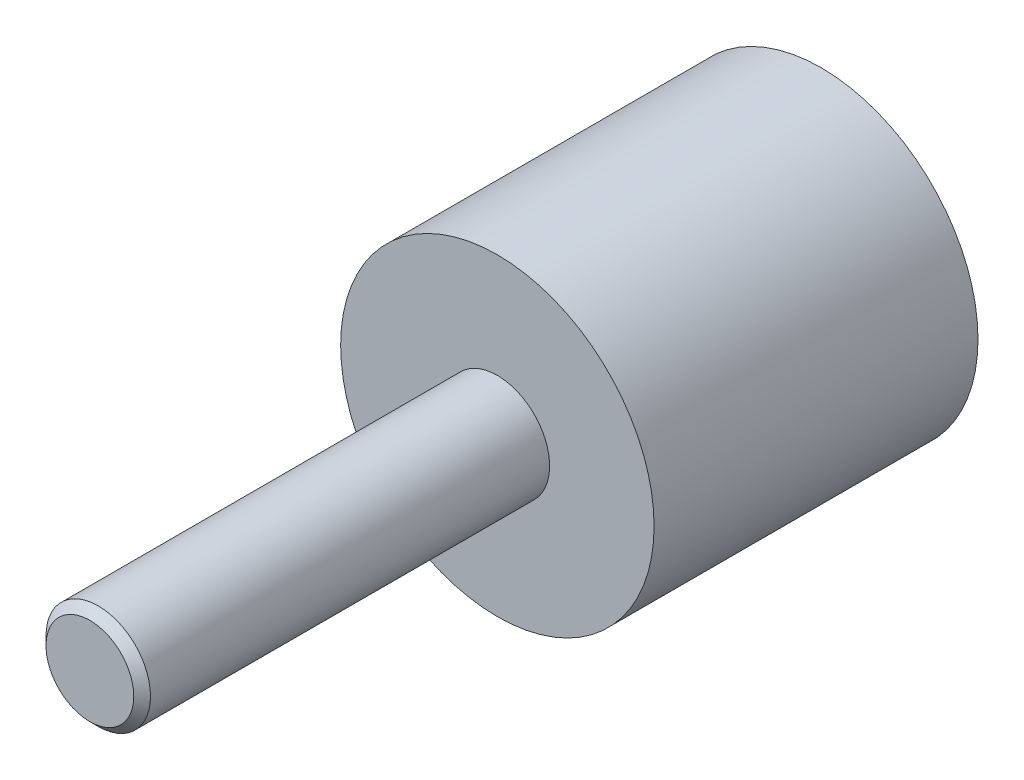
from build123d import *

# Parameters (mm, degrees)
F_1_2_0_5_DIAMETER_HOLE2_D     = 12.7
F_1_2_0_5_DIAMETER_HOLE2_DEPTH = 12.7
F_1_2_0_5_DIAMETER_HOLE2_TIP   = 3.815464931
F_4_40_TAPPED_HOLE1_REACH      = 51.289
F_4_40_TAPPED_HOLE1_BORE_R     = 1.1303
CHAMFER1_SIZE                  = 0.508


with BuildPart() as part:
    # Sketch → Shaft (revolve)
    with BuildSketch(Plane(origin=(0, 0, 0), x_dir=(0, 0, -1), z_dir=(1, 0, 0)), mode=Mode.PRIVATE) as shaft_sk:
        Polygon((0, 0), (0, 3.175), (24.765, 3.175), (24.765, 9.525), (44.45, 9.525), (44.45, 0), align=None)
    revolve(shaft_sk.sketch.rotate(Axis((0, 0, -44.45), (0, 0, 1)), 90), axis=Axis((0, 0, -44.45), (0, 0, 1)))

    # 1/2 (0.5) Diameter Hole2
    with Locations(Plane(origin=(0, 0, -44.45), x_dir=(-1, 0, 0), z_dir=(0, 0, -1))):
        with Locations((0, 0)):
            Hole(F_1_2_0_5_DIAMETER_HOLE2_D / 2, depth=F_1_2_0_5_DIAMETER_HOLE2_DEPTH)
            with Locations((0, 0, -(F_1_2_0_5_DIAMETER_HOLE2_DEPTH + F_1_2_0_5_DIAMETER_HOLE2_TIP / 2))):  # 118° drill point
                Cone(0, F_1_2_0_5_DIAMETER_HOLE2_D / 2, F_1_2_0_5_DIAMETER_HOLE2_TIP, mode=Mode.SUBTRACT)

    # #4-40 Tapped Hole1 bore → #4-40 Tapped Hole1 (cut, up to next)
    with BuildSketch(Plane(origin=(0, -9.525, 0), x_dir=(-1, 0, 0), z_dir=(0, -1, 0)), mode=Mode.PRIVATE) as f_4_40_tapped_hole1_sk1:
        with Locations((0, 34.925)):
            Circle(F_4_40_TAPPED_HOLE1_BORE_R)
    f_4_40_tapped_hole1_tool1 = extrude(f_4_40_tapped_hole1_sk1.sketch, amount=-F_4_40_TAPPED_HOLE1_REACH, mode=Mode.PRIVATE) & part.part
    # #4-40 Tapped Hole1 bore → #4-40 Tapped Hole1 (cut, up to next)
    with BuildSketch(Plane(origin=(0, -9.525, 0), x_dir=(-1, 0, 0), z_dir=(0, -1, 0)), mode=Mode.PRIVATE) as f_4_40_tapped_hole1_sk2:
        with Locations((0, 41.275)):
            Circle(F_4_40_TAPPED_HOLE1_BORE_R)
    f_4_40_tapped_hole1_tool2 = extrude(f_4_40_tapped_hole1_sk2.sketch, amount=-F_4_40_TAPPED_HOLE1_REACH, mode=Mode.PRIVATE) & part.part
    add(f_4_40_tapped_hole1_tool1.solids().sort_by_distance((0, -9.525, -34.925))[0], mode=Mode.SUBTRACT)
    add(f_4_40_tapped_hole1_tool2.solids().sort_by_distance((0, -9.525, -41.275))[0], mode=Mode.SUBTRACT)

    # Chamfer1
    chamfer1_edges = [part.edges().sort_by_distance(p)[0] for p in [
        (-6.35, 0, -44.45),
        (3.175, 0, 0),
    ]]
    chamfer(chamfer1_edges, length=CHAMFER1_SIZE)


solid = part.part
